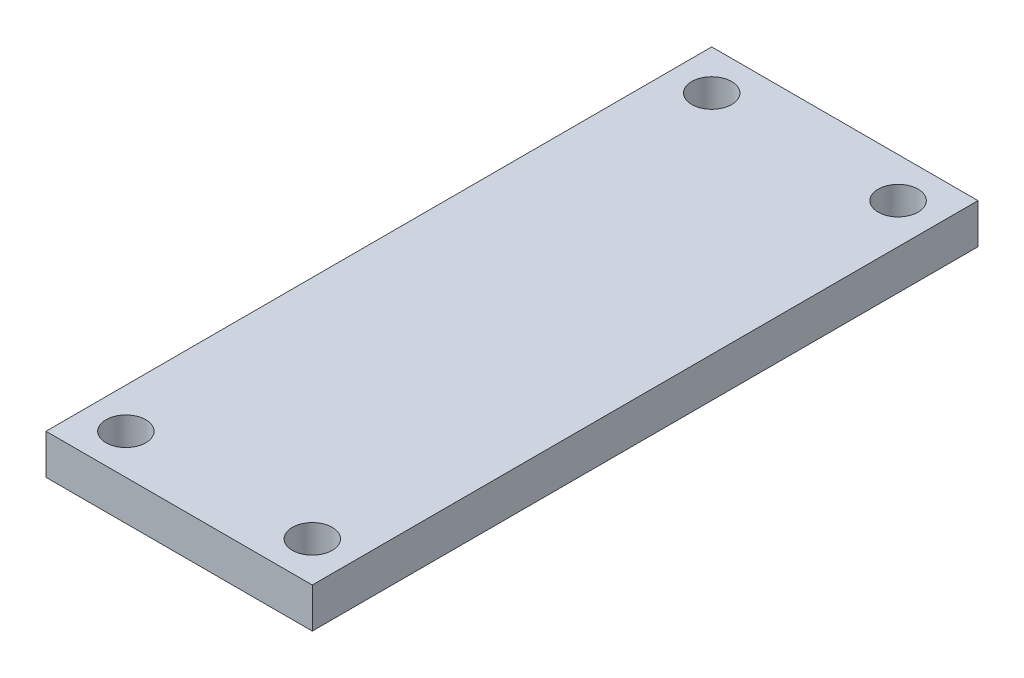
from build123d import *

# Parameters (mm, degrees)
SKETCH1_W           = 20
SKETCH1_H           = 50
BOSS_EXTRUDE1_DEPTH = 1.5
CUT_EXTRUDE1_REACH  = 29.092
SKETCH2_R           = 1.5


with BuildPart() as part:
    # Sketch1 → Boss-Extrude1 (new, symmetric)
    with BuildSketch(Plane(origin=(0, 0, 0), x_dir=(1, 0, 0), z_dir=(0, 1, 0))):
        Rectangle(SKETCH1_W, SKETCH1_H)
    extrude(amount=BOSS_EXTRUDE1_DEPTH, both=True)

    # Sketch2 → Cut-Extrude1 (cut, up to next)
    with BuildSketch(Plane(origin=(0, 1.5, 0), x_dir=(1, 0, 0), z_dir=(0, 1, 0)), mode=Mode.PRIVATE) as cut_extrude1_sk1:
        with Locations(Location((-7, -22, 0), (0, 0, 270))):
            Circle(SKETCH2_R)
    cut_extrude1_tool1 = extrude(cut_extrude1_sk1.sketch, amount=-CUT_EXTRUDE1_REACH, mode=Mode.PRIVATE) & part.part
    # Sketch2 → Cut-Extrude1 (cut, up to next)
    with BuildSketch(Plane(origin=(0, 1.5, 0), x_dir=(1, 0, 0), z_dir=(0, 1, 0)), mode=Mode.PRIVATE) as cut_extrude1_sk2:
        with Locations(Location((7, -22, 0), (0, 0, 270))):
            Circle(SKETCH2_R)
    cut_extrude1_tool2 = extrude(cut_extrude1_sk2.sketch, amount=-CUT_EXTRUDE1_REACH, mode=Mode.PRIVATE) & part.part
    # Sketch2 → Cut-Extrude1 (cut, up to next)
    with BuildSketch(Plane(origin=(0, 1.5, 0), x_dir=(1, 0, 0), z_dir=(0, 1, 0)), mode=Mode.PRIVATE) as cut_extrude1_sk3:
        with Locations(Location((7, 22, 0), (0, 0, 270))):
            Circle(SKETCH2_R)
    cut_extrude1_tool3 = extrude(cut_extrude1_sk3.sketch, amount=-CUT_EXTRUDE1_REACH, mode=Mode.PRIVATE) & part.part
    # Sketch2 → Cut-Extrude1 (cut, up to next)
    with BuildSketch(Plane(origin=(0, 1.5, 0), x_dir=(1, 0, 0), z_dir=(0, 1, 0)), mode=Mode.PRIVATE) as cut_extrude1_sk4:
        with Locations(Location((-7, 22, 0), (0, 0, 270))):
            Circle(SKETCH2_R)
    cut_extrude1_tool4 = extrude(cut_extrude1_sk4.sketch, amount=-CUT_EXTRUDE1_REACH, mode=Mode.PRIVATE) & part.part
    add(cut_extrude1_tool1.solids().sort_by_distance((-7, 1.5, 22))[0], mode=Mode.SUBTRACT)
    add(cut_extrude1_tool2.solids().sort_by_distance((7, 1.5, 22))[0], mode=Mode.SUBTRACT)
    add(cut_extrude1_tool3.solids().sort_by_distance((7, 1.5, -22))[0], mode=Mode.SUBTRACT)
    add(cut_extrude1_tool4.solids().sort_by_distance((-7, 1.5, -22))[0], mode=Mode.SUBTRACT)


solid = part.part
